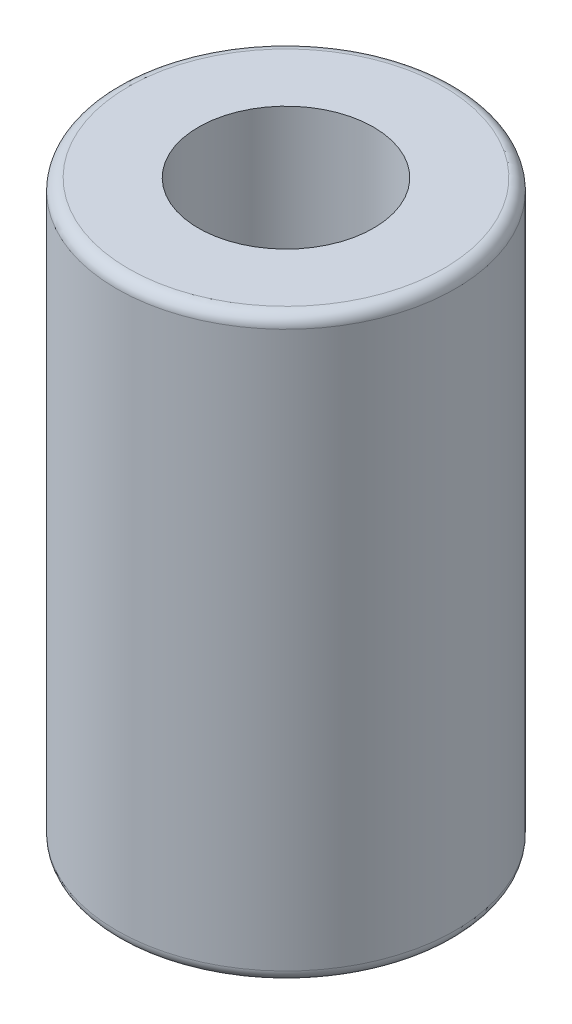
from build123d import *

# Parameters (mm, degrees)
SKETCH1_R           = 7.25
SKETCH1_R_2         = 3.75
BOSS_EXTRUDE1_DEPTH = 24.8
FILLET1_R           = 0.5


with BuildPart() as part:
    # Sketch1 → Boss-Extrude1 (new body)
    with BuildSketch(Plane(origin=(0, 0, 0), x_dir=(1, 0, 0), z_dir=(0, 1, 0))):
        with Locations(Location((0, 0, 0), (0, 0, 90))):
            Circle(SKETCH1_R)
        with Locations(Location((0, 0, 0), (0, 0, 90))):
            Circle(SKETCH1_R_2, mode=Mode.SUBTRACT)
    extrude(amount=BOSS_EXTRUDE1_DEPTH)

    # Fillet1
    fillet1_edges = [part.edges().sort_by_distance(p)[0] for p in [
        (0, 0, 7.25),
        (0, 24.8, 7.25),
    ]]
    fillet(fillet1_edges, radius=FILLET1_R)


solid = part.part
